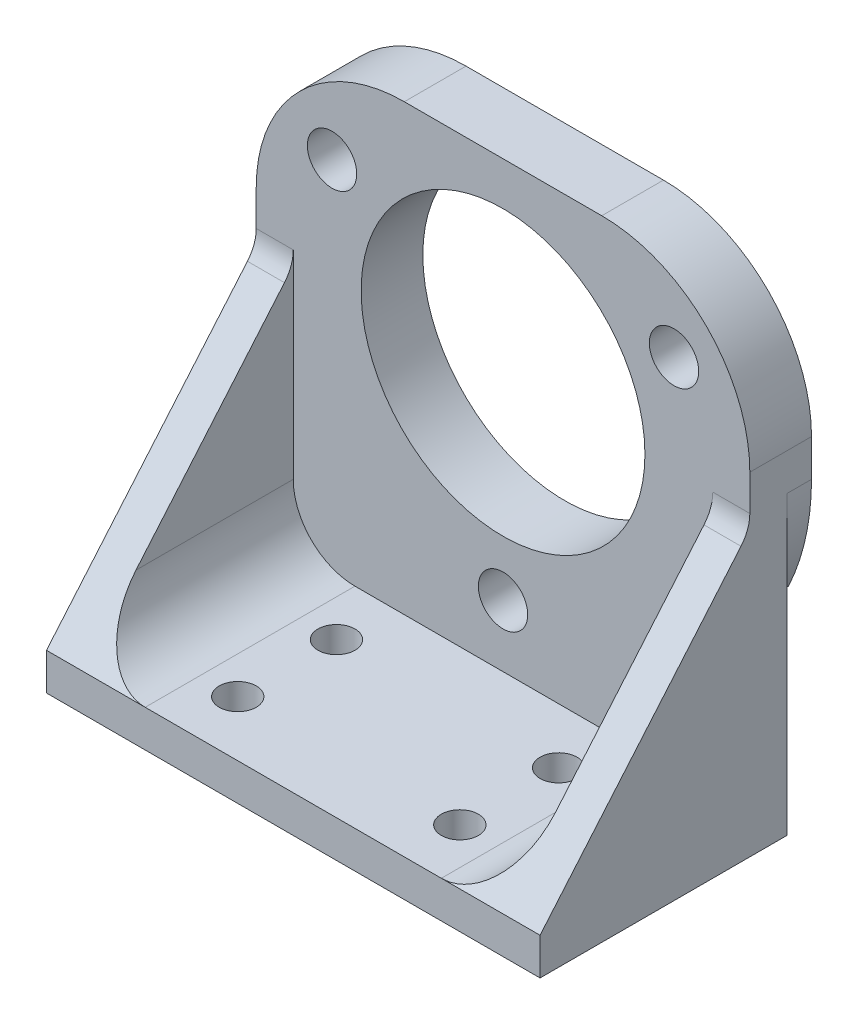
from build123d import *

# Parameters (mm, degrees)
SKETCH_1_W           = 40
SKETCH_1_H           = 20
EXTRUDE_1_DEPTH      = 3
SKETCH_2_W           = 40
SKETCH_2_H           = 3
EXTRUDE_2_DEPTH      = 36
SKETCH_3_R           = 11.5
SKETCH_3_R_2         = 2
CUT_EXTRUDE_M5_DEPTH = 48.010637094
FILLET_1_R           = 12
SKETCH_4_R           = 2
SKETCH_4_R_2         = 11.5
EXTRUDE_3_DEPTH      = 2
SKETCH_5_R           = 3
CUT_EXTRUDE_2_DEPTH  = 2
SKETCH_6_W           = 3
SKETCH_6_H           = 17
EXTRUDE_4_DEPTH      = 20
CUT_EXTRUDE_3_DEPTH  = 58.140178509
SKETCH_8_R           = 1.5
CUT_EXTRUDE_4_DEPTH  = 43.895221179
FILLET_2_R           = 5
FILLET_3_R           = 3


with BuildPart() as part:
    # 草图1 → 凸台-拉伸1 (new body)
    with BuildSketch(Plane(origin=(0, 0, 0), x_dir=(1, 0, 0), z_dir=(0, 1, 0))):
        Rectangle(SKETCH_1_W, SKETCH_1_H)
    extrude(amount=EXTRUDE_1_DEPTH)

    # 草图2 → 凸台-拉伸2 (add)
    with BuildSketch(Plane(origin=(0, 3, 0), x_dir=(1, 0, 0), z_dir=(0, 1, 0))):
        with Locations((0, 8.5)):
            Rectangle(SKETCH_2_W, SKETCH_2_H)
    extrude(amount=EXTRUDE_2_DEPTH)

    # 草图3 → 螺纹-M5 (cut, through all)
    with BuildSketch(Plane.XY.offset(-7)):
        with Locations((0, 24)):
            Circle(SKETCH_3_R)
        with Locations((13.856406461, 32)):
            Circle(SKETCH_3_R_2)
        with Locations((0, 8)):
            Circle(SKETCH_3_R_2)
        with Locations((-13.856406461, 32)):
            Circle(SKETCH_3_R_2)
    extrude(amount=-CUT_EXTRUDE_M5_DEPTH, mode=Mode.SUBTRACT)

    # 圆角1
    fillet_1_edges = [part.edges().sort_by_distance(p)[0] for p in [
        (-20, 39, -8.5),
        (20, 39, -8.5),
    ]]
    fillet(fillet_1_edges, radius=FILLET_1_R)

    # 草图4 → 凸台-拉伸3 (add)
    with BuildSketch(Plane(origin=(0, 0, -10), x_dir=(-1, 0, 0), z_dir=(0, 0, -1))):
        with BuildLine():
            Line((-8, 39), (8, 39))
            ThreePointArc((8, 39), (16.485281374, 35.485281374), (20, 27))
            Line((20, 27), (20, 24))
            ThreePointArc((20, 24), (0, 4), (-20, 24))
            Line((-20, 24), (-20, 27))
            ThreePointArc((-20, 27), (-16.485281374, 35.485281374), (-8, 39))
        make_face()
        with Locations(Location((0, 8, 0), (0, 0, 180))):
            Circle(SKETCH_4_R, mode=Mode.SUBTRACT)
        with Locations(Location((13.856406461, 32, 0), (0, 0, 180))):
            Circle(SKETCH_4_R, mode=Mode.SUBTRACT)
        with Locations(Location((-13.856406461, 32, 0), (0, 0, 180))):
            Circle(SKETCH_4_R, mode=Mode.SUBTRACT)
        with Locations(Location((0, 24, 0), (0, 0, 180))):
            Circle(SKETCH_4_R_2, mode=Mode.SUBTRACT)
    extrude(amount=EXTRUDE_3_DEPTH)

    # 草图5 → 切除-拉伸2 (cut)
    with BuildSketch(Plane(origin=(0, 0, -12), x_dir=(-1, 0, 0), z_dir=(0, 0, -1))):
        with Locations((-15.155444566, 15.25)):
            Circle(SKETCH_5_R)
        with Locations((15.155444566, 15.25)):
            Circle(SKETCH_5_R)
    extrude(amount=-CUT_EXTRUDE_2_DEPTH, mode=Mode.SUBTRACT)

    # 草图6 → 凸台-拉伸4 (add)
    with BuildSketch(Plane(origin=(0, 3, 0), x_dir=(1, 0, 0), z_dir=(0, 1, 0))):
        with Locations((-18.5, -1.5)):
            Rectangle(SKETCH_6_W, SKETCH_6_H)
        with Locations((18.5, -1.5)):
            Rectangle(SKETCH_6_W, SKETCH_6_H)
    extrude(amount=EXTRUDE_4_DEPTH)

    # 草图7 → 切除-拉伸3 (cut, through all)
    with BuildSketch(Plane.ZY.offset(20)):
        Polygon((-7, 23), (10, 3), (10, 23), align=None)
    extrude(amount=-CUT_EXTRUDE_3_DEPTH, mode=Mode.SUBTRACT)

    # 草图8 → 切除-拉伸4 (cut, through all)
    with BuildSketch(Plane(origin=(0, 3, 0), x_dir=(1, 0, 0), z_dir=(0, 1, 0))):
        with Locations(Location((-9, 2.5, 0), (0, 0, 270))):
            Circle(SKETCH_8_R)
        with Locations(Location((9, 2.5, 0), (0, 0, 90))):
            Circle(SKETCH_8_R)
        with Locations(Location((9, -5.5, 0), (0, 0, 270))):
            Circle(SKETCH_8_R)
        with Locations(Location((-9, -5.5, 0), (0, 0, 90))):
            Circle(SKETCH_8_R)
    extrude(amount=-CUT_EXTRUDE_4_DEPTH, mode=Mode.SUBTRACT)

    # 圆角2
    fillet_2_edges = [part.edges().sort_by_distance(p)[0] for p in [
        (-17, 3, 1.5),
        (17, 3, 1.5),
    ]]
    fillet(fillet_2_edges, radius=FILLET_2_R)

    # 圆角3
    fillet_3_edges = [part.edges().sort_by_distance(p)[0] for p in [
        (-18.5, 23, -7),
        (18.5, 23, -7),
    ]]
    fillet(fillet_3_edges, radius=FILLET_3_R)


solid = part.part
